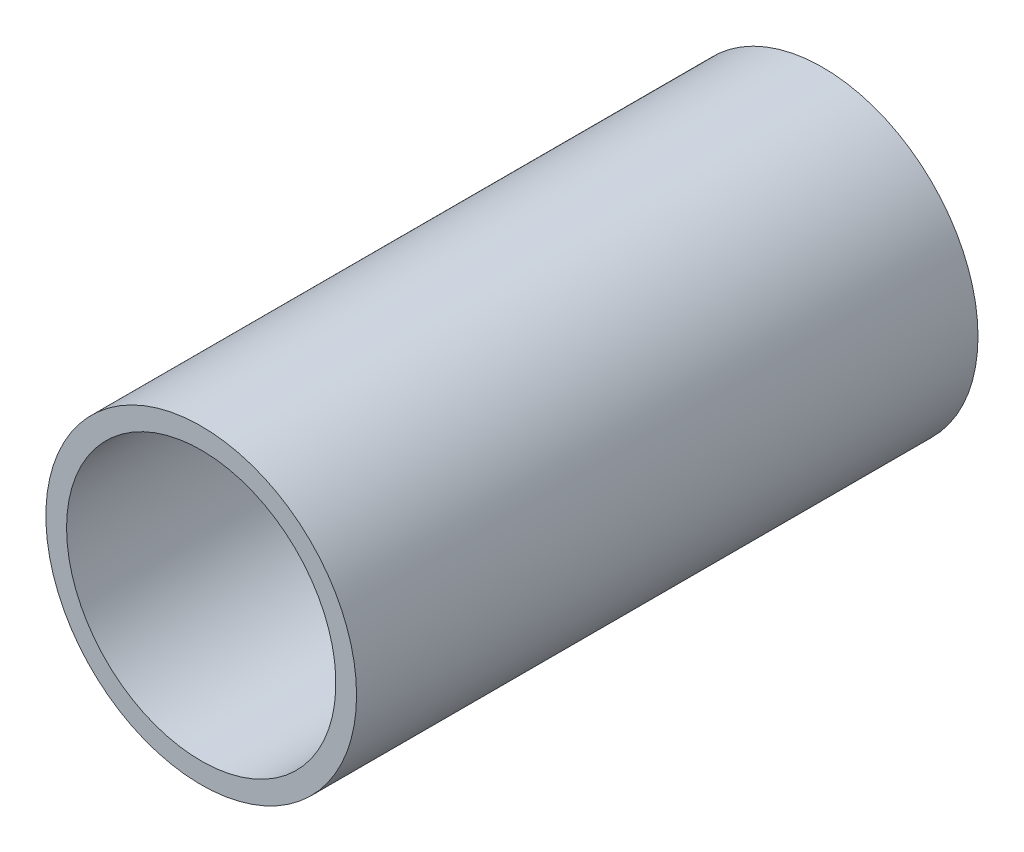
from build123d import *

# Parameters (mm, degrees)
SKETCH_1_R          = 15
EXTRUDE_1_DEPTH     = 60
SKETCH_4_R          = 13
CUT_EXTRUDE_1_DEPTH = 64.639610307


with BuildPart() as part:
    # 草图1 → 凸台-拉伸1 (new body)
    with BuildSketch(Plane.XY):
        Circle(SKETCH_1_R)
    extrude(amount=EXTRUDE_1_DEPTH)

    # 草图4 → 切除-拉伸1 (cut, through all)
    with BuildSketch(Plane(origin=(0, 0, 0), x_dir=(-1, 0, 0), z_dir=(0, 0, -1))):
        Circle(SKETCH_4_R)
    extrude(amount=-CUT_EXTRUDE_1_DEPTH, mode=Mode.SUBTRACT)


solid = part.part
